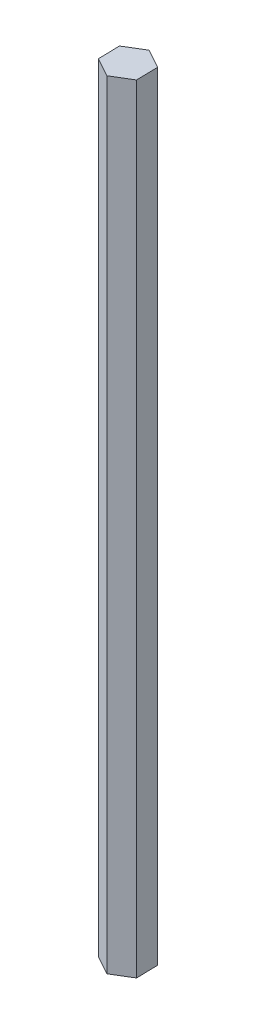
from build123d import *

# Parameters (mm, degrees)
BOSS_EXTRUDE1_DEPTH = 83


with BuildPart() as part:
    # Sketch1 → Boss-Extrude1 (new body)
    with BuildSketch(Plane(origin=(0, 0, 0), x_dir=(1, 0, 0), z_dir=(0, 1, 0))):
        Polygon((2.022866267, -1.114156811), (1.976321236, 1.19477517), (-0.046545031, 2.308931981), (-2.022866267, 1.114156811), (-1.976321236, -1.19477517), (0.046545031, -2.308931981), align=None)
    extrude(amount=BOSS_EXTRUDE1_DEPTH)


solid = part.part
